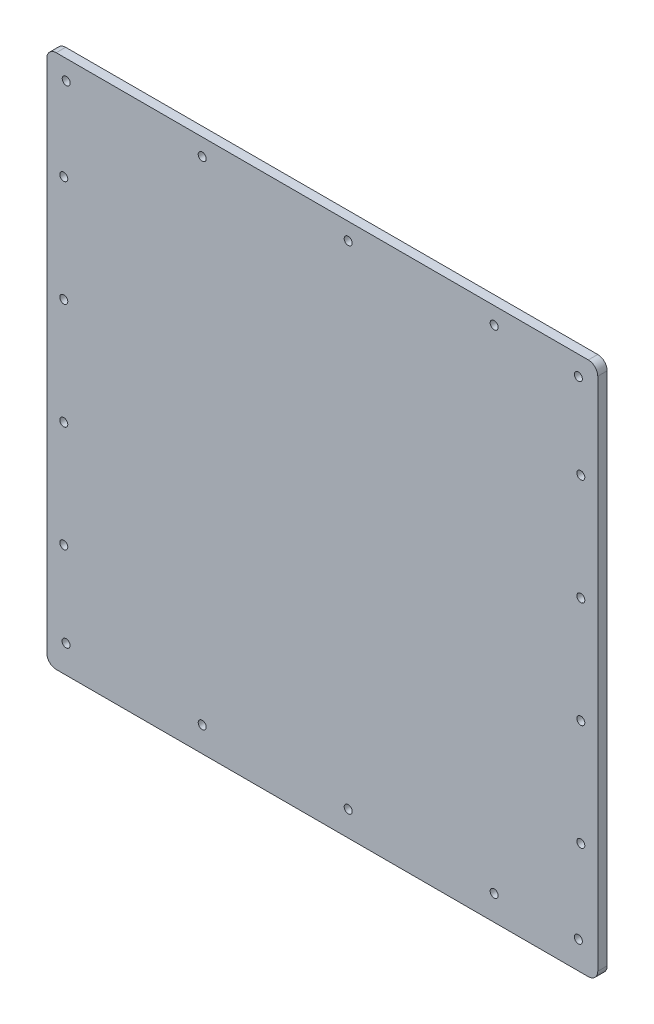
from build123d import *

# Parameters (mm, degrees)
BOSS_EXTRUDE1_DEPTH    = 10
M10X1_5_TAPPED_HOLE2_D = 8.5


with BuildPart() as part:
    # Sketch1 → Boss-Extrude1 (new body)
    with BuildSketch(Plane.XY):
        with BuildLine():
            Line((-2.5, -432.308814801), (562.5, -432.308814801))
            ThreePointArc((562.5, -432.308814801), (569.571067812, -429.379882613), (572.5, -422.308814801))
            Line((572.5, -422.308814801), (572.5, 124.876051617))
            ThreePointArc((572.5, 124.876051617), (569.571067812, 131.947119429), (562.5, 134.876051617))
            Line((562.5, 134.876051617), (-2.5, 134.876051617))
            ThreePointArc((-2.5, 134.876051617), (-9.571067812, 131.947119429), (-12.5, 124.876051617))
            Line((-12.5, 124.876051617), (-12.5, -422.308814801))
            ThreePointArc((-12.5, -422.308814801), (-9.571067812, -429.379882613), (-2.5, -432.308814801))
        make_face()
    extrude(amount=BOSS_EXTRUDE1_DEPTH)

    # M10x1.5 Tapped Hole2 (through all)
    with Locations(Plane.XY.offset(10)):
        with Locations((8.106601718, 114.269449899), (152.5, 116.876051617), (307.5, 116.876051617), (462.5, 116.876051617), (551.893398282, 114.269449899), (554.5, 24.876051617), (554.5, -87.988903856), (554.5, -200.853859328), (554.5, -313.718814801), (551.893398282, -403.112213083), (462.5, -405.718814801), (307.5, -405.718814801), (152.5, -405.718814801), (7.943137307, -402.946189682), (5.5, -313.718814801), (5.5, -200.853859328), (5.5, -87.988903856), (5.5, 24.876051617)):
            Hole(M10X1_5_TAPPED_HOLE2_D / 2)


solid = part.part
